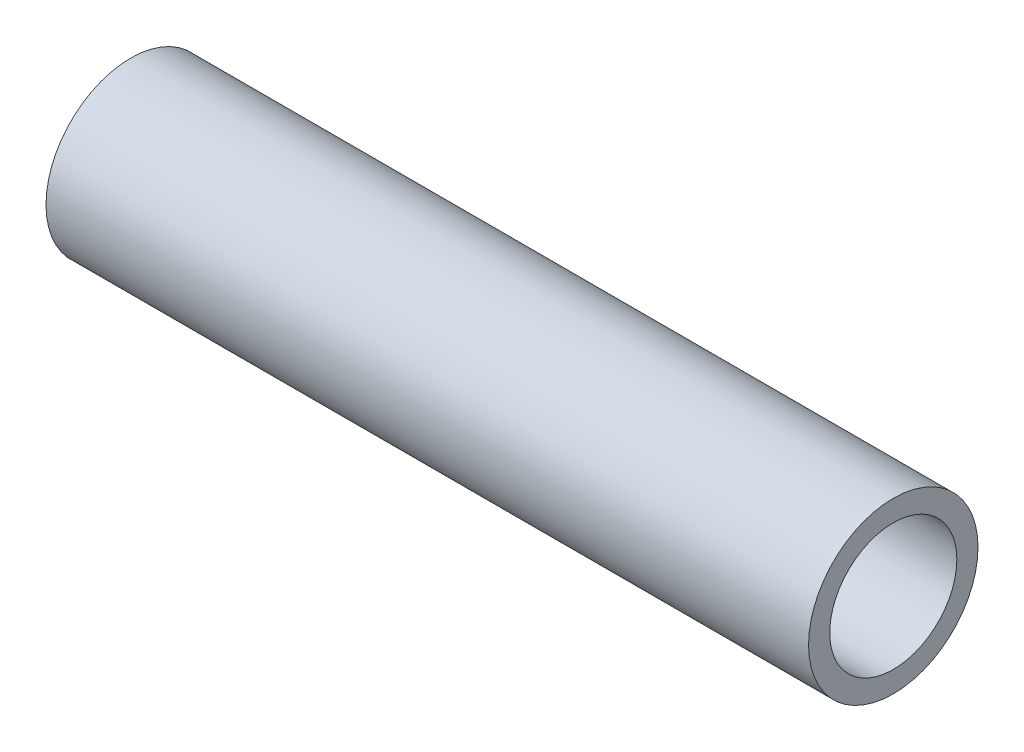
from build123d import *

# Parameters (mm, degrees)
SKETCH1_R                  = 12.7
SKETCH1_R_2                = 9.525
ALUMINA_TUBE_EXTRUDE_DEPTH = 114.3


with BuildPart() as part:
    # Sketch1 → Alumina Tube Extrude (new body)
    with BuildSketch(Plane(origin=(0, 0, 0), x_dir=(0, 0, -1), z_dir=(1, 0, 0))):
        Circle(SKETCH1_R)
        Circle(SKETCH1_R_2, mode=Mode.SUBTRACT)
    extrude(amount=ALUMINA_TUBE_EXTRUDE_DEPTH)


solid = part.part
